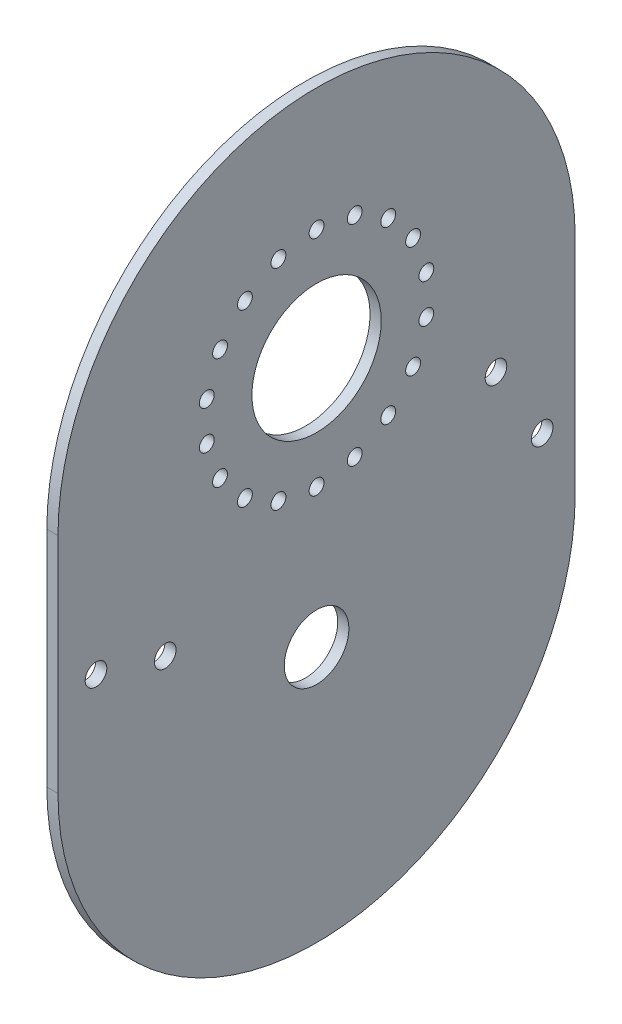
from build123d import *

# Parameters (mm, degrees)
SKETCH1_R           = 29
SKETCH1_R_2         = 14.5
SKETCH1_R_3         = 4.85
BOSS_EXTRUDE1_DEPTH = 5
SCALE1_SCALE        = 1.5
SKETCH2_R           = 5
CUT_EXTRUDE1_DEPTH  = 10


with BuildPart() as part:
    # Sketch1 → Boss-Extrude1 (new body)
    with BuildSketch(Plane(origin=(0, 0, 0), x_dir=(0, 0, -1), z_dir=(1, 0, 0))):
        with BuildLine():
            Line((116, 50.1), (116, -50.1))
            ThreePointArc((116, -50.1), (0, -166.1), (-116, -50.1))
            Line((-116, -50.1), (-116, 50.1))
            ThreePointArc((-116, 50.1), (0, 166.1), (116, 50.1))
        make_face()
        with Locations((0, 61.077179293)):
            Circle(SKETCH1_R, mode=Mode.SUBTRACT)
        with Locations((0, -51.244320707)):
            Circle(SKETCH1_R_2, mode=Mode.SUBTRACT)
        with Locations((80.472730607, 15.380858581)):
            Circle(SKETCH1_R_3, mode=Mode.SUBTRACT)
        with Locations((101.210456573, -18.715580545)):
            Circle(SKETCH1_R_3, mode=Mode.SUBTRACT)
        with Locations((-67.898806967, -20.724176458)):
            Circle(SKETCH1_R_3, mode=Mode.SUBTRACT)
        with Locations((-98.945842281, -12.367503179)):
            Circle(SKETCH1_R_3, mode=Mode.SUBTRACT)
    extrude(amount=BOSS_EXTRUDE1_DEPTH)


with BuildPart() as part_1:
    # Scale1: scaled about (2.5, -2.015956771, 0.017708556)
    add(part.part.scale(SCALE1_SCALE).moved(Location((-1.25, 1.007978385, -0.008854278))))

    # Sketch2 → Cut-Extrude1 (cut)
    with BuildSketch(Plane(origin=(6.25, 0, 0), x_dir=(0, 0, -1), z_dir=(1, 0, 0))):
        with Locations((0.008854278, 167.623747325)):
            Circle(SKETCH2_R)
        with Locations((25.660365027, 163.100693884)):
            Circle(SKETCH2_R)
        with Locations((48.217925004, 150.077080559)):
            Circle(SKETCH2_R)
        with Locations((64.960759562, 130.123747325)):
            Circle(SKETCH2_R)
        with Locations((73.869435754, 105.64736065)):
            Circle(SKETCH2_R)
        with Locations((73.869435754, 79.600134)):
            Circle(SKETCH2_R)
        with Locations((64.960759562, 55.123747325)):
            Circle(SKETCH2_R)
        with Locations((48.217925004, 35.170414091)):
            Circle(SKETCH2_R)
        with Locations((25.660365027, 22.146800766)):
            Circle(SKETCH2_R)
        with Locations((0.008854278, 17.623747325)):
            Circle(SKETCH2_R)
        with Locations((-25.642656472, 22.146800766)):
            Circle(SKETCH2_R)
        with Locations((-48.200216449, 35.170414091)):
            Circle(SKETCH2_R)
        with Locations((-64.943051006, 55.123747325)):
            Circle(SKETCH2_R)
        with Locations((-73.851727198, 79.600134)):
            Circle(SKETCH2_R)
        with Locations((-73.851727198, 105.64736065)):
            Circle(SKETCH2_R)
        with Locations((-64.943051006, 130.123747325)):
            Circle(SKETCH2_R)
        with Locations((-48.200216449, 150.077080559)):
            Circle(SKETCH2_R)
        with Locations((-25.642656472, 163.100693884)):
            Circle(SKETCH2_R)
    extrude(amount=-CUT_EXTRUDE1_DEPTH, mode=Mode.SUBTRACT)


solid = part_1.part
